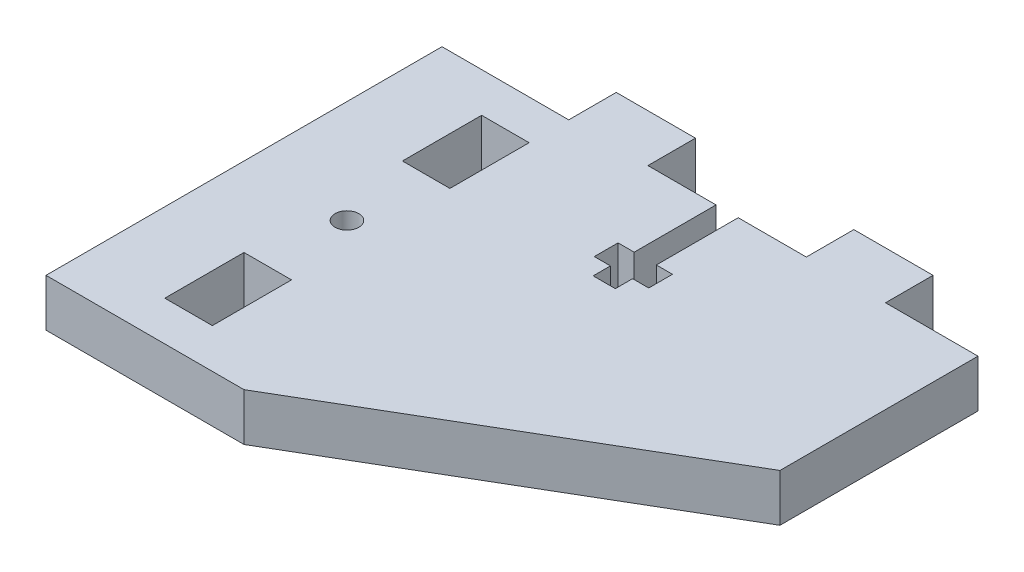
from build123d import *

# Parameters (mm, degrees)
SKETCH_1_R      = 1.5
SKETCH_1_W      = 6
SKETCH_1_H      = 10
EXTRUDE_2_DEPTH = 6


with BuildPart() as part:
    # Эскиз1 → Бобышка-Вытянуть2 (new body)
    with BuildSketch(Plane(origin=(0, 0, 0), x_dir=(1, 0, 0), z_dir=(0, 1, 0))):
        Polygon((-3.416793382, 32.742423734), (5.183206618, 32.742423734), (5.183206618, 22.407164878), (3.146696627, 22.407214255), (3.146623876, 19.406616385), (5.182814398, 19.407762757), (5.184095658, 17.225944952), (7.984095175, 17.227589235), (7.982815638, 19.406473379), (10.020338121, 19.407669902), (10.020410843, 22.407047597), (7.983206618, 22.40709699), (7.983206618, 32.742423734), (16.583206618, 32.742423734), (16.583206618, 38.742423734), (26.583206618, 38.742423734), (26.583206618, 32.742423734), (38.259419898, 32.742423734), (38.255234849, 7.742423734), (-4.416793382, -17.257576266), (-29.416793382, -17.257576266), (-29.416793382, 32.742423734), (-13.416793382, 32.742423734), (-13.416793382, 38.742423734), (-3.416793382, 38.742423734), align=None)
        with Locations(Location((-16.416793382, 7.742423734, 0), (0, 0, 270))):
            Circle(SKETCH_1_R, mode=Mode.SUBTRACT)
        with Locations((-16.416793382, 22.742423734)):
            Rectangle(SKETCH_1_W, SKETCH_1_H, mode=Mode.SUBTRACT)
        with Locations((-16.416793382, -7.257576266)):
            Rectangle(SKETCH_1_W, SKETCH_1_H, mode=Mode.SUBTRACT)
    extrude(amount=EXTRUDE_2_DEPTH)


solid = part.part
